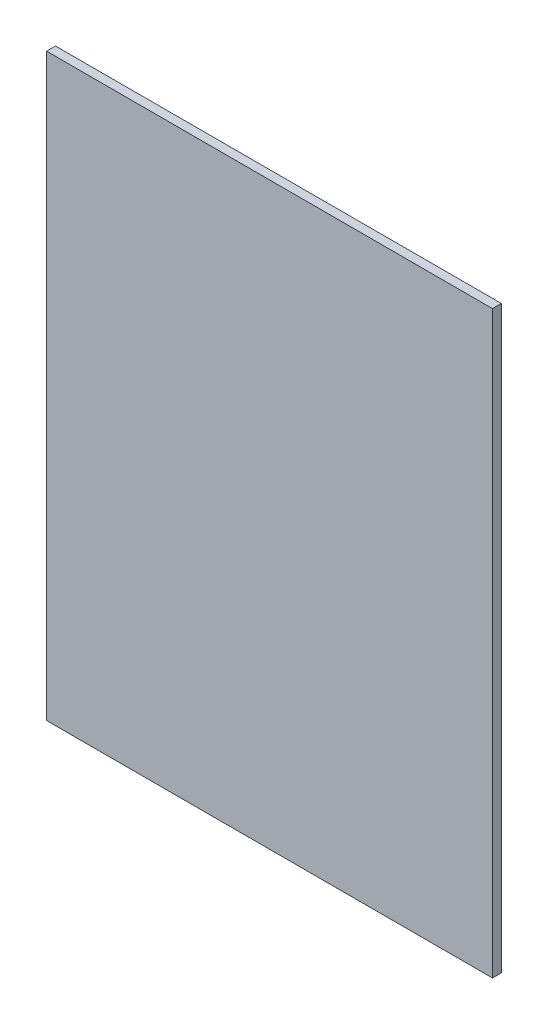
from build123d import *

# Parameters (mm, degrees)
SKETCH1_W           = 100
SKETCH1_H           = 130
BOSS_EXTRUDE1_DEPTH = 1


with BuildPart() as part:
    # Sketch1 → Boss-Extrude1 (new, symmetric)
    with BuildSketch(Plane.XY):
        Rectangle(SKETCH1_W, SKETCH1_H)
    extrude(amount=BOSS_EXTRUDE1_DEPTH, both=True)


solid = part.part
